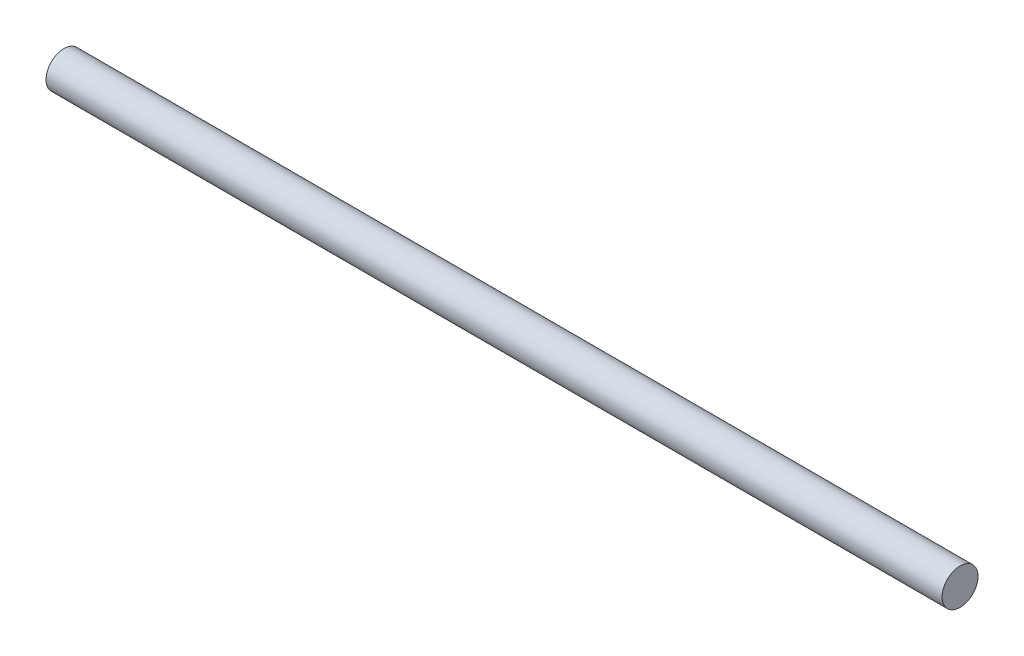
from build123d import *

# Parameters (mm, degrees)
SKETCH1_R           = 19.05
BOSS_EXTRUDE1_DEPTH = 949.96


with BuildPart() as part:
    # Sketch1 → Boss-Extrude1 (new body)
    with BuildSketch(Plane(origin=(0, 0, 0), x_dir=(0, 0, -1), z_dir=(1, 0, 0))):
        with Locations(Location((0, 0, 0), (0, 0, 180))):
            Circle(SKETCH1_R)
    extrude(amount=BOSS_EXTRUDE1_DEPTH)


solid = part.part
